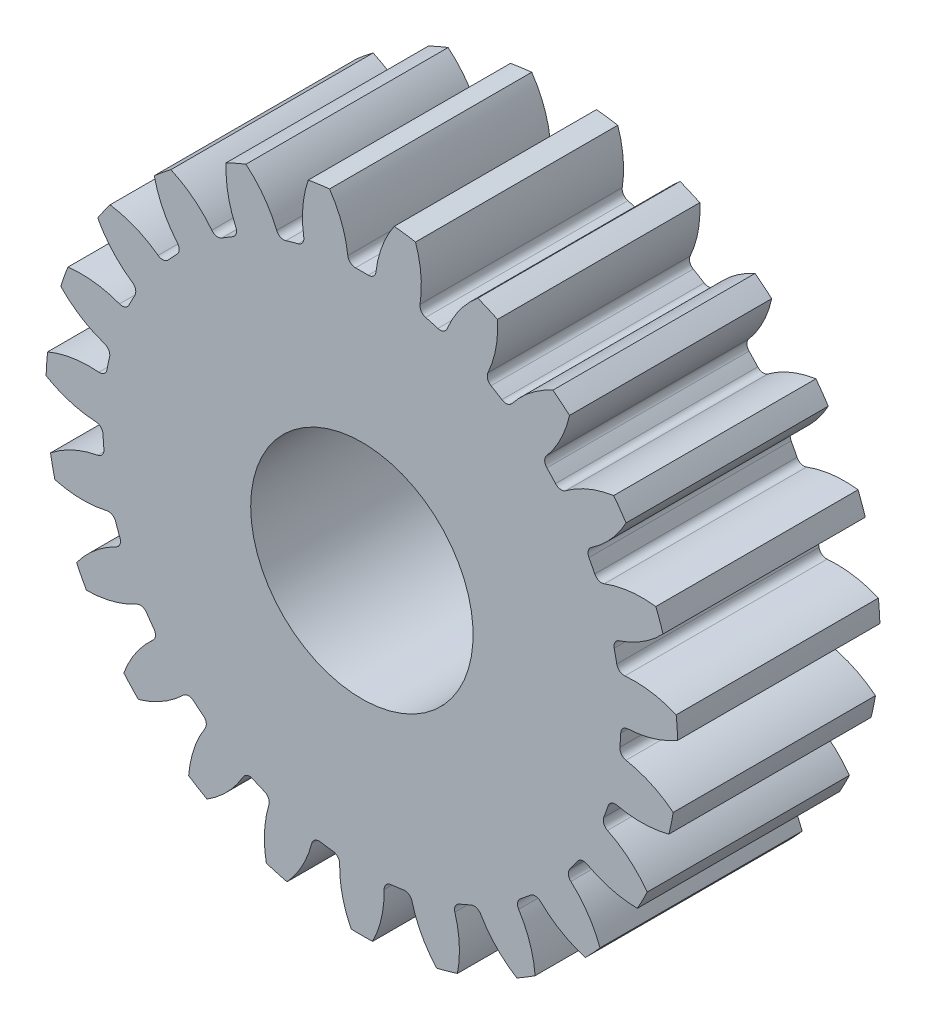
from build123d import *

# Parameters (mm, degrees)
SKETCH2_R                = 15.625
BOSS_EXTRUDE1_DEPTH      = 5
CUT_EXTRUDE1_DEPTH       = 23.6557112
FILLET1_R                = 0.375
CIRPATTERN1_COUNT        = 23
FILLET1_OF_CIRPATTERN1_R = 0.375
SKETCH4_R                = 5.5
CUT_EXTRUDE3_DEPTH       = 10


with BuildPart() as part:
    # Sketch2 → Boss-Extrude1 (new, symmetric)
    with BuildSketch(Plane.XY):
        Circle(SKETCH2_R)
    extrude(amount=BOSS_EXTRUDE1_DEPTH, both=True)

    # Sketch3 → Cut-Extrude1 (cut, symmetric)
    with BuildSketch(Plane.XY):
        with BuildLine():
            ThreePointArc((0.666625055, 12.795146239), (0, 12.8125), (-0.666625055, 12.795146239))
            ThreePointArc((-0.666625055, 12.795146239), (-0.943066669, 14.233732128), (-1.600537264, 15.542808802))
            ThreePointArc((-1.600537264, 15.542808802), (0, 15.625), (1.600537264, 15.542808802))
            ThreePointArc((1.600537264, 15.542808802), (0.943066669, 14.233732128), (0.666625055, 12.795146239))
        make_face()
    cut_extrude1 = extrude(amount=CUT_EXTRUDE1_DEPTH, both=True, mode=Mode.SUBTRACT)

    # Fillet1
    fillet1_edges = [part.edges().sort_by_distance(p)[0] for p in [
        (0.666625055, 12.795146239, 0),
        (-0.666625055, 12.795146239, 0),
    ]]
    fillet(fillet1_edges, radius=FILLET1_R)

    # CirPattern1: Cut-Extrude1 ×23 about axis
    cirpattern1_axis = Axis((0, 0, -11), (0, 0, 1))
    for i in range(1, CIRPATTERN1_COUNT):
        add(cut_extrude1.rotate(cirpattern1_axis, i * 360 / CIRPATTERN1_COUNT), mode=Mode.SUBTRACT)

    # Fillet1 of CirPattern1
    fillet1_of_cirpattern1_edges = [part.edges().sort_by_distance(p)[0] for p in [
        (-2.810184352, 12.500520795, 0),
        (-4.093993932, 12.140814221, 0),
        (-6.078575242, 11.27878891, 0),
        (-7.217730007, 10.586053552, 0),
        (-8.896146013, 9.220560849, 0),
        (-9.806160067, 8.246173719, 0),
        (-11.053930332, 6.47848597, 0),
        (-11.667312094, 5.294712905, 0),
        (-12.391895207, 3.255931424, 0),
        (-12.663152958, 1.950567456, 0),
        (-12.810809903, -0.208100661, 0),
        (-12.719825698, -1.538242657, 0),
        (-12.279605434, -3.656698871, 0),
        (-11.833127154, -4.912968349, 0),
        (-10.837678806, -6.834096455, 0),
        (-10.068819703, -7.923321655, 0),
        (-8.591971119, -9.504640368, 0),
        (-7.557753956, -10.34603844, 0),
        (-5.709036241, -11.470268587, 0),
        (-4.486164172, -12.001436884, 0),
        (-2.402688261, -12.585199457, 0),
        (-1.081856115, -12.766743657, 0),
        (1.081856115, -12.766743657, 0),
        (2.402688261, -12.585199457, 0),
        (4.486164172, -12.001436884, 0),
        (5.709036241, -11.470268587, 0),
        (7.557753956, -10.34603844, 0),
        (8.591971119, -9.504640368, 0),
        (10.068819703, -7.923321655, 0),
        (10.837678806, -6.834096455, 0),
        (11.833127154, -4.912968349, 0),
        (12.279605434, -3.656698871, 0),
        (12.719825698, -1.538242657, 0),
        (12.810809903, -0.208100661, 0),
        (12.663152958, 1.950567456, 0),
        (12.391895207, 3.255931424, 0),
        (11.667312094, 5.294712905, 0),
        (11.053930332, 6.47848597, 0),
        (9.806160067, 8.246173719, 0),
        (8.896146013, 9.220560849, 0),
        (7.217730007, 10.586053552, 0),
        (6.078575242, 11.27878891, 0),
        (4.093993932, 12.140814221, 0),
        (2.810184352, 12.500520795, 0),
    ]]
    fillet(fillet1_of_cirpattern1_edges, radius=FILLET1_OF_CIRPATTERN1_R)

    # Sketch4 → Cut-Extrude3 (cut)
    with BuildSketch(Plane(origin=(0, 0, -5), x_dir=(-1, 0, 0), z_dir=(0, 0, -1))):
        Circle(SKETCH4_R)
    extrude(amount=-CUT_EXTRUDE3_DEPTH, mode=Mode.SUBTRACT)


solid = part.part
